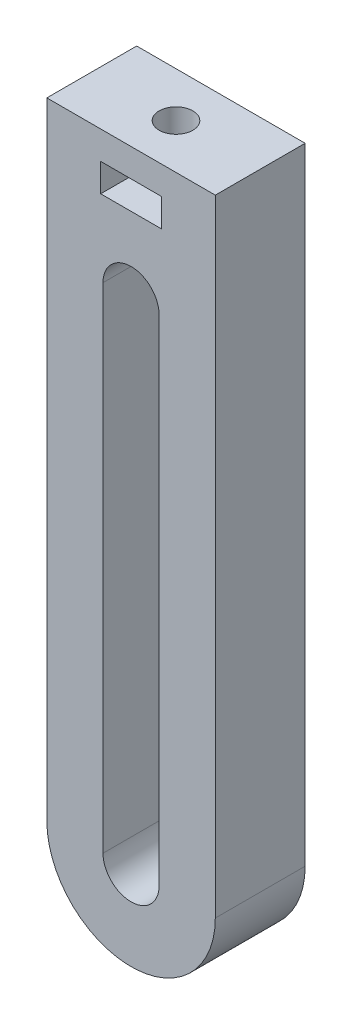
from build123d import *

# Parameters (mm, degrees)
BOSS_EXTRUDE1_DEPTH     = 8
CUT_EXTRUDE2_START      = -2.5
CUT_EXTRUDE2_DEPTH      = 2.5
SKETCH4_W               = 5.41
SKETCH4_H               = 2.5
CUT_EXTRUDE3_DEPTH      = 4
CUT_EXTRUDE4_REACH      = 66.194
CUT_EXTRUDE4_END_RADIUS = 2.5
SKETCH5_R               = 1.5


with BuildPart() as part:
    # Sketch1 → Boss-Extrude1 (new body)
    with BuildSketch(Plane.XY):
        with BuildLine():
            Line((-7.5, 33.75), (7.5, 33.75))
            Line((7.5, 33.75), (7.5, -22))
            ThreePointArc((7.5, -22), (0, -29.5), (-7.5, -22))
            Line((-7.5, -22), (-7.5, 33.75))
        make_face()
        with BuildLine():
            Line((2.5, 22), (2.5, -22))
            ThreePointArc((2.5, -22), (0, -24.5), (-2.5, -22))
            Line((-2.5, -22), (-2.5, 22))
            ThreePointArc((-2.5, 22), (0, 24.5), (2.5, 22))
        make_face(mode=Mode.SUBTRACT)
    extrude(amount=BOSS_EXTRUDE1_DEPTH)

    # Sketch3 → Cut-Extrude2 (cut)
    with BuildSketch(Plane(origin=(0, 33.75, 0), x_dir=(1, 0, 0), z_dir=(0, 1, 0)).offset(CUT_EXTRUDE2_START)):
        Polygon((0, -7.123464956), (2.705, -5.561732478), (2.705, -2.438267522), (0, -0.876535044), (-2.705, -2.438267522), (-2.705, -5.561732478), align=None)
    extrude(amount=-CUT_EXTRUDE2_DEPTH, mode=Mode.SUBTRACT)

    # Sketch4 → Cut-Extrude3 (cut)
    with BuildSketch(Plane.XY.offset(8)):
        with Locations((0, 30)):
            Rectangle(SKETCH4_W, SKETCH4_H)
    extrude(amount=-CUT_EXTRUDE3_DEPTH, mode=Mode.SUBTRACT)

    # Cut-Extrude4: up to this cylinder (the profile starts outside it)
    cut_extrude4_end = Plane(origin=(0, 22, 4), z_dir=(0, 0, -1)) * Cylinder(CUT_EXTRUDE4_END_RADIUS, 138.388, mode=Mode.PRIVATE)
    # Sketch5 → Cut-Extrude4 (cut, up to the surface)
    with BuildSketch(Plane(origin=(0, 33.75, 0), x_dir=(1, 0, 0), z_dir=(0, 1, 0)), mode=Mode.PRIVATE) as cut_extrude4_sk1:
        with Locations(Location((0, -4, 0), (0, 0, 270))):
            Circle(SKETCH5_R)
    cut_extrude4_tool1 = extrude(cut_extrude4_sk1.sketch, amount=-CUT_EXTRUDE4_REACH, mode=Mode.PRIVATE) - cut_extrude4_end
    add(cut_extrude4_tool1.solids().sort_by_distance((0, 33.75, 4))[0], mode=Mode.SUBTRACT)


solid = part.part
